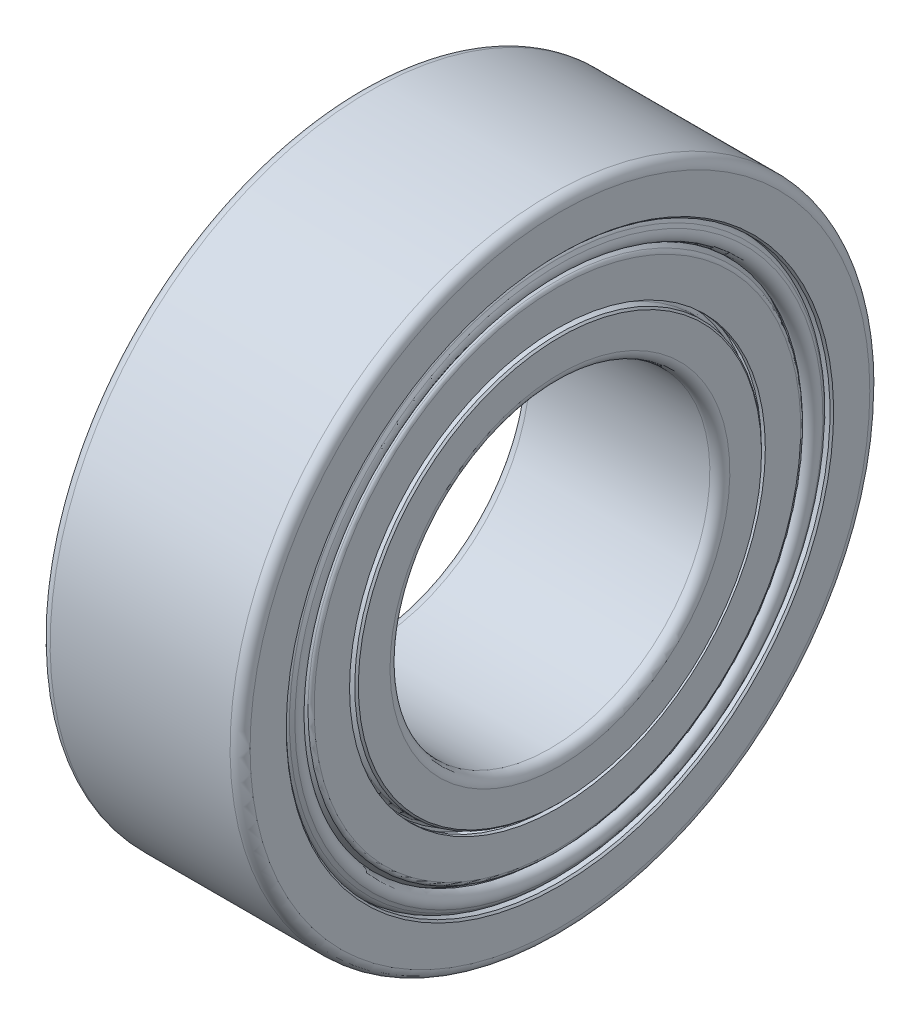
from build123d import *


with BuildPart() as part:
    # Sketch3 → Revolve1 (revolve)
    with BuildSketch(Plane.XY, mode=Mode.PRIVATE) as revolve1_sk:
        with BuildLine():
            Line((-2.25, 8), (2.25, 8))
            ThreePointArc((2.25, 8), (2.426776695, 7.926776695), (2.5, 7.75))
            Line((2.5, 7.75), (2.5, 6.845))
            Line((2.5, 6.845), (2.455, 6.8))
            Line((2.455, 6.8), (2.125, 6.8))
            Line((2.125, 6.8), (2.125, 6.872))
            Line((2.125, 6.872), (-2.125, 6.872))
            Line((-2.125, 6.872), (-2.125, 6.8))
            Line((-2.125, 6.8), (-2.455, 6.8))
            Line((-2.455, 6.8), (-2.5, 6.845))
            Line((-2.5, 6.845), (-2.5, 7.75))
            ThreePointArc((-2.5, 7.75), (-2.426776695, 7.926776695), (-2.25, 8))
        make_face()
        with BuildLine():
            Line((-2.455, 5.086796875), (-2.5, 5.041796875))
            Line((-2.5, 5.041796875), (-2.5, 4.25))
            ThreePointArc((-2.5, 4.25), (-2.426776695, 4.073223305), (-2.25, 4))
            Line((-2.25, 4), (2.25, 4))
            ThreePointArc((2.25, 4), (2.426776695, 4.073223305), (2.5, 4.25))
            Line((2.5, 4.25), (2.5, 5.041796875))
            Line((2.5, 5.041796875), (2.455, 5.086796875))
            Line((2.455, 5.086796875), (2.236328125, 5.086796875))
            ThreePointArc((2.236328125, 5.086796875), (2.139061512, 5.118012497), (2.078125, 5.2))
            Line((2.078125, 5.2), (2.078125, 5.272))
            Line((2.078125, 5.272), (-2.078125, 5.272))
            Line((-2.078125, 5.272), (-2.078125, 5.2))
            ThreePointArc((-2.078125, 5.2), (-2.139061512, 5.118012497), (-2.236328125, 5.086796875))
            Line((-2.236328125, 5.086796875), (-2.455, 5.086796875))
        make_face()
    revolve(revolve1_sk.sketch.rotate(Axis((-2.25, 0, 0), (1, 0, 0)), 180), axis=Axis((-2.25, 0, 0), (1, 0, 0)))


with BuildPart() as body_2:
    # Sketch4 → Revolve-Thin1 (revolve)
    with BuildSketch(Plane.XY, mode=Mode.PRIVATE) as revolve_thin1_sk:
        with BuildLine():
            ThreePointArc((2.284166667, 6.37339746), (2.388089715, 6.43339746), (2.388089715, 6.55339746))
            Line((2.388089715, 6.55339746), (2.338089715, 6.64))
            ThreePointArc((2.338089715, 6.64), (2.203108381, 6.695911099), (2.114166667, 6.58))
            Line((2.114166667, 6.58), (2.114166667, 6.351946644))
            ThreePointArc((2.114166667, 6.351946644), (2.117516032, 6.339446644), (2.126666667, 6.330296009))
            Line((2.126666667, 6.330296009), (2.38125, 6.183312253))
            ThreePointArc((2.38125, 6.183312253), (2.422427858, 6.142134395), (2.4375, 6.085884395))
            Line((2.4375, 6.085884395), (2.4375, 5.2))
            Line((2.4375, 5.2), (2.3375, 5.2))
            Line((2.3375, 5.2), (2.3375, 6.085884395))
            ThreePointArc((2.3375, 6.085884395), (2.335825318, 6.092134395), (2.33125, 6.096709712))
            Line((2.33125, 6.096709712), (2.076666667, 6.243693468))
            ThreePointArc((2.076666667, 6.243693468), (2.030913491, 6.289446644), (2.014166667, 6.351946644))
            Line((2.014166667, 6.351946644), (2.014166667, 6.58))
            ThreePointArc((2.014166667, 6.58), (2.177226477, 6.792503682), (2.424692255, 6.69))
            Line((2.424692255, 6.69), (2.474692255, 6.60339746))
            ThreePointArc((2.474692255, 6.60339746), (2.474692255, 6.38339746), (2.284166667, 6.27339746))
            Line((2.284166667, 6.27339746), (2.284166667, 6.37339746))
        make_face()
    revolve(revolve_thin1_sk.sketch.rotate(Axis((-2.25, 0, 0), (1, 0, 0)), 180), axis=Axis((-2.25, 0, 0), (1, 0, 0)))


with BuildPart() as body_3:
    # Mirror2: mirrored copy
    add(body_2.part.mirror(Plane(origin=(0, 0, 0), x_dir=(0, 0, 1), z_dir=(1, 0, 0))))


with BuildPart() as body_3_2:
    # Mirror1: mirrored copy
    add(body_2.part.mirror(Plane(origin=(0, 0, 0), x_dir=(0, 0, 1), z_dir=(1, 0, 0))))


solid = Compound([part.part, body_2.part, body_3_2.part])
